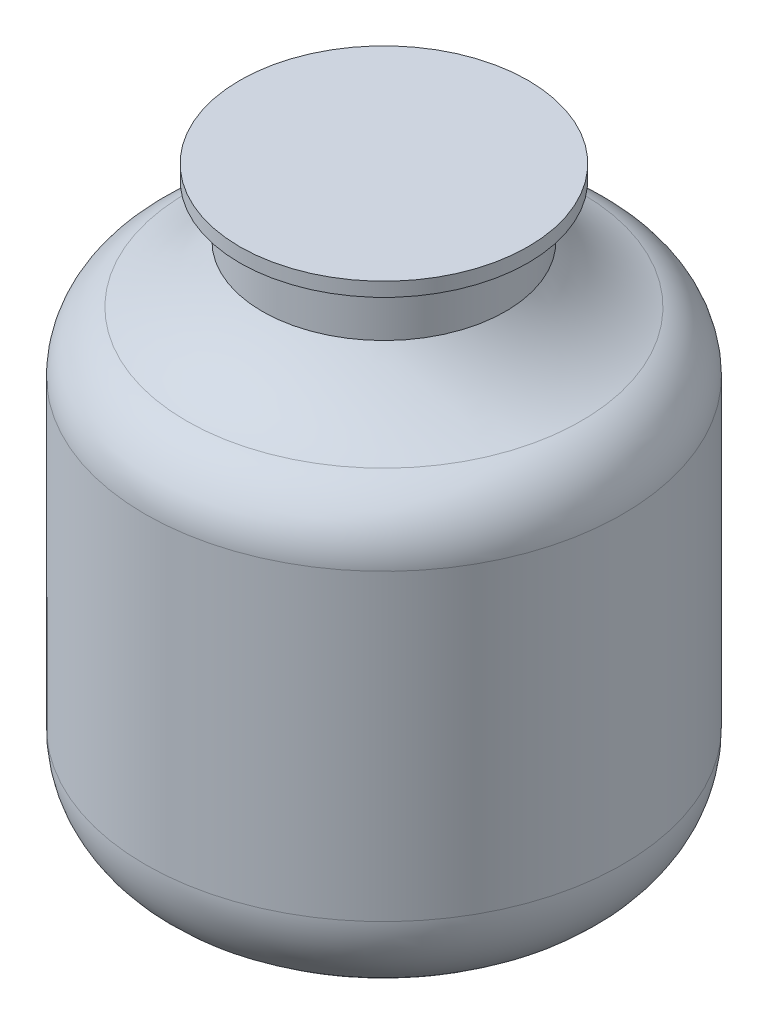
from build123d import *


with BuildPart() as part:
    # Sketch1 → Revolve1 (revolve)
    with BuildSketch(Plane.XY, mode=Mode.PRIVATE) as revolve1_sk:
        with BuildLine():
            Line((0, 0), (24.360145845, 0))
            ThreePointArc((24.360145845, 0), (35.651483834, 4.677025332), (40.328509165, 15.96836332))
            Line((40.328509165, 15.96836332), (40.328509165, 67.23016629))
            ThreePointArc((40.328509165, 67.23016629), (38.415383352, 73.392914659), (33.348649325, 77.388878138))
            ThreePointArc((33.348649325, 77.388878138), (26.276782154, 81.308753559), (20.55607493, 87.022792188))
            Line((20.55607493, 87.022792188), (20.55607493, 96.024974169))
            Line((20.55607493, 96.024974169), (24.360145845, 96.024974169))
            Line((24.360145845, 96.024974169), (24.360145845, 98.393969428))
            Line((24.360145845, 98.393969428), (0, 98.393969428))
            Line((0, 98.393969428), (0, 0))
        make_face()
    revolve(revolve1_sk.sketch.rotate(Axis((0, 98.393969428, 0), (0, -1, 0)), 90), axis=Axis((0, 98.393969428, 0), (0, -1, 0)))


solid = part.part
